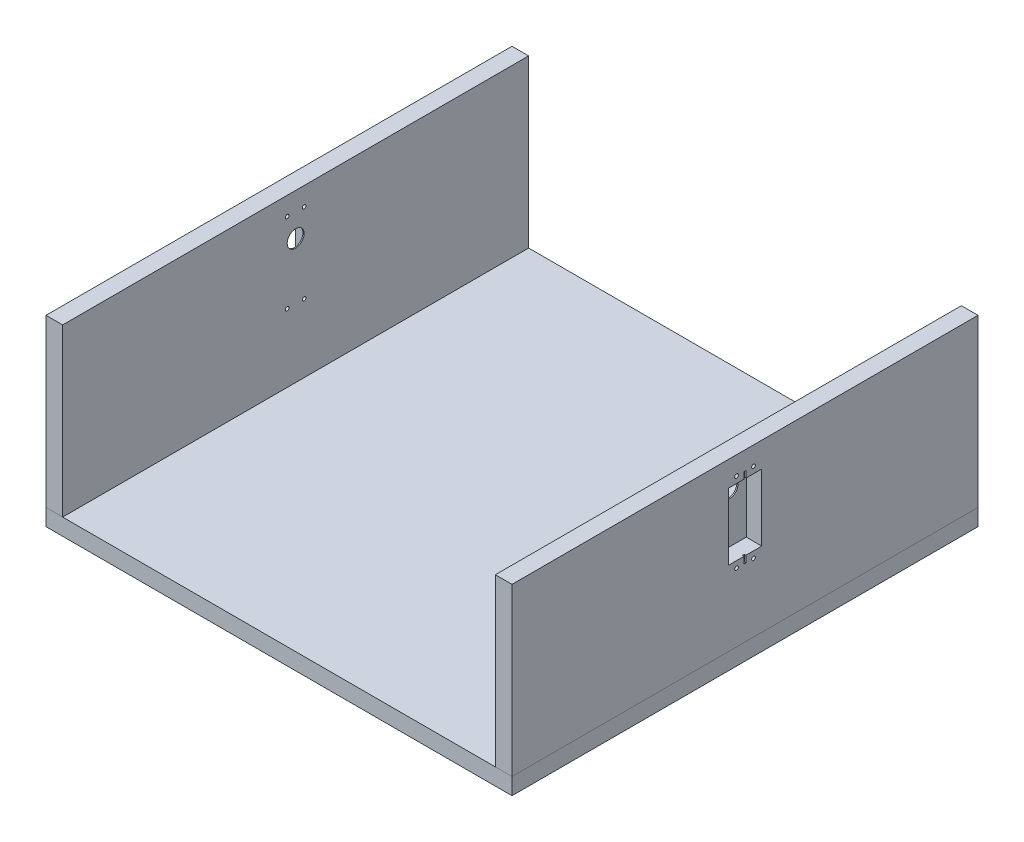
from build123d import *

# Parameters (mm, degrees)
SKETCH1_W             = 280
SKETCH1_H             = 280
BOSS_EXTRUDE1_DEPTH   = 10
SKETCH3_W             = 10
SKETCH3_H             = 280
BOSS_EXTRUDE2_DEPTH   = 100
BOSS_EXTRUDE2_2_DEPTH = 100
SKETCH4_W             = 20.12
SKETCH4_H             = 40.12
CUT_EXTRUDE2_DEPTH    = 9.3
SKETCH8_W             = 1.1
SKETCH8_H             = 48.12
CUT_EXTRUDE5_DEPTH    = 1
SKETCH5_R             = 5.075
CUT_EXTRUDE3_DEPTH    = 10
SKETCH7_R             = 1.125
CUT_EXTRUDE4_DEPTH    = 20


with BuildPart() as part:
    # Sketch1 → Boss-Extrude1 (new body)
    with BuildSketch(Plane(origin=(0, 0, 0), x_dir=(1, 0, 0), z_dir=(0, 1, 0))):
        Rectangle(SKETCH1_W, SKETCH1_H)
    extrude(amount=BOSS_EXTRUDE1_DEPTH)


with BuildPart() as body_2:
    # Sketch3 → Boss-Extrude2 (new body)
    with BuildSketch(Plane(origin=(0, 10, 0), x_dir=(1, 0, 0), z_dir=(0, 1, 0))):
        with Locations((135, 0)):
            Rectangle(SKETCH3_W, SKETCH3_H)
    extrude(amount=BOSS_EXTRUDE2_DEPTH)

    # Sketch4 → Cut-Extrude2 (cut)
    with BuildSketch(Plane(origin=(140, 0, 0), x_dir=(0, 0, -1), z_dir=(1, 0, 0))):
        with Locations((0, 74.94)):
            Rectangle(SKETCH4_W, SKETCH4_H)
    cut_extrude2 = extrude(amount=-CUT_EXTRUDE2_DEPTH, mode=Mode.SUBTRACT)

    # Sketch8 → Cut-Extrude5 (cut)
    with BuildSketch(Plane(origin=(140, 0, 0), x_dir=(0, 0, -1), z_dir=(1, 0, 0))):
        with Locations((0, 74.94)):
            Rectangle(SKETCH8_W, SKETCH8_H)
    cut_extrude5 = extrude(amount=-CUT_EXTRUDE5_DEPTH, mode=Mode.SUBTRACT)

    # Sketch5 → Cut-Extrude3 (cut)
    with BuildSketch(Plane(origin=(130.7, 0, 0), x_dir=(0, 0, -1), z_dir=(1, 0, 0))):
        with Locations((0, 85)):
            Circle(SKETCH5_R)
    cut_extrude3 = extrude(amount=-CUT_EXTRUDE3_DEPTH, mode=Mode.SUBTRACT)

    # Sketch7 → Cut-Extrude4 (cut)
    with BuildSketch(Plane(origin=(140, 0, 0), x_dir=(0, 0, -1), z_dir=(1, 0, 0))):
        with Locations((-5.1, 98.9)):
            Circle(SKETCH7_R)
        with Locations((5.1, 98.9)):
            Circle(SKETCH7_R)
        with Locations((5.1, 50.98)):
            Circle(SKETCH7_R)
        with Locations((-5.1, 50.98)):
            Circle(SKETCH7_R)
    cut_extrude4 = extrude(amount=-CUT_EXTRUDE4_DEPTH, mode=Mode.SUBTRACT)


with BuildPart() as body_3:
    # Sketch3 → Boss-Extrude2 2 (new body)
    with BuildSketch(Plane(origin=(0, 10, 0), x_dir=(1, 0, 0), z_dir=(0, 1, 0))):
        with Locations((-135, 0)):
            Rectangle(SKETCH3_W, SKETCH3_H)
    extrude(amount=BOSS_EXTRUDE2_2_DEPTH)

    # Mirror1: Cut-Extrude2, Cut-Extrude5, Cut-Extrude3, Cut-Extrude4 across plane
    add(cut_extrude2.mirror(Plane(origin=(0, 0, 0), x_dir=(0, 0, 1), z_dir=(1, 0, 0))), mode=Mode.SUBTRACT)
    add(cut_extrude5.mirror(Plane(origin=(0, 0, 0), x_dir=(0, 0, 1), z_dir=(1, 0, 0))), mode=Mode.SUBTRACT)
    add(cut_extrude3.mirror(Plane(origin=(0, 0, 0), x_dir=(0, 0, 1), z_dir=(1, 0, 0))), mode=Mode.SUBTRACT)
    add(cut_extrude4.mirror(Plane(origin=(0, 0, 0), x_dir=(0, 0, 1), z_dir=(1, 0, 0))), mode=Mode.SUBTRACT)


solid = Compound([part.part, body_2.part, body_3.part])
